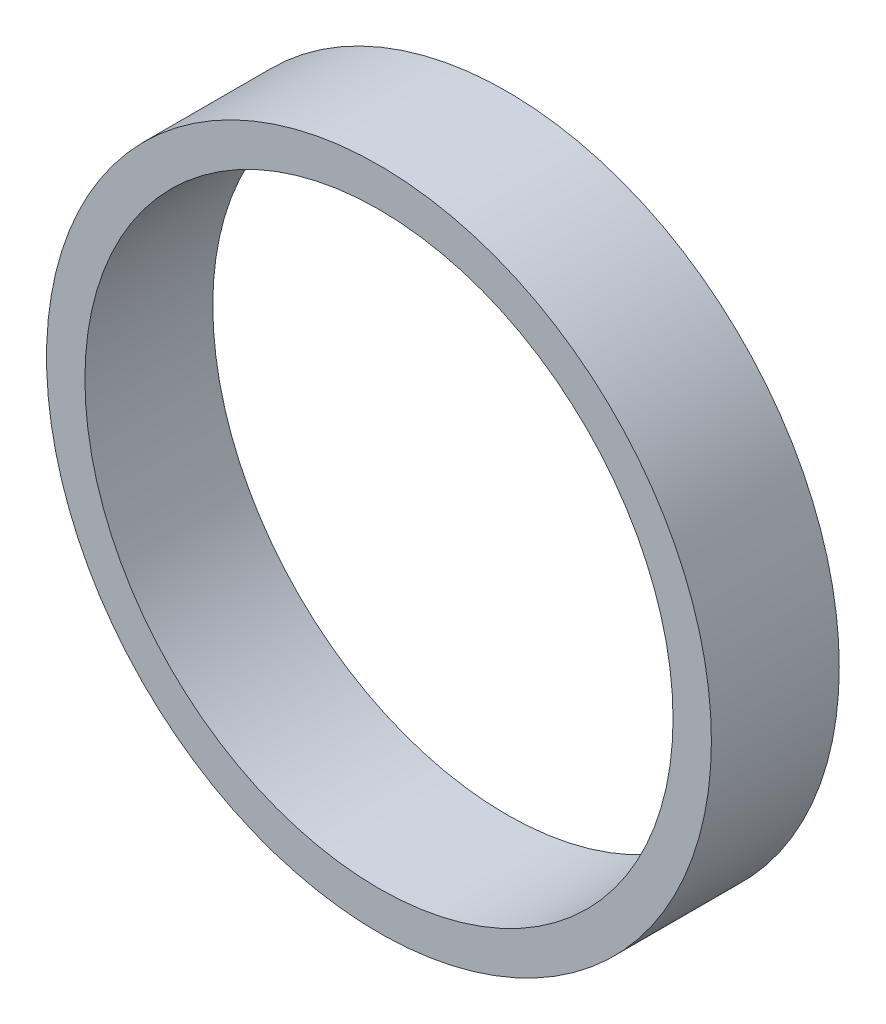
from build123d import *

# Parameters (mm, degrees)
SZKIC1_R                    = 26
SZKIC1_R_2                  = 23
DODANIE_WYCI_GNI_CIE1_DEPTH = 10


with BuildPart() as part:
    # Szkic1 → Dodanie-wyciągnięcie1 (new body)
    with BuildSketch(Plane.XY):
        Circle(SZKIC1_R)
        Circle(SZKIC1_R_2, mode=Mode.SUBTRACT)
    extrude(amount=DODANIE_WYCI_GNI_CIE1_DEPTH)


solid = part.part
